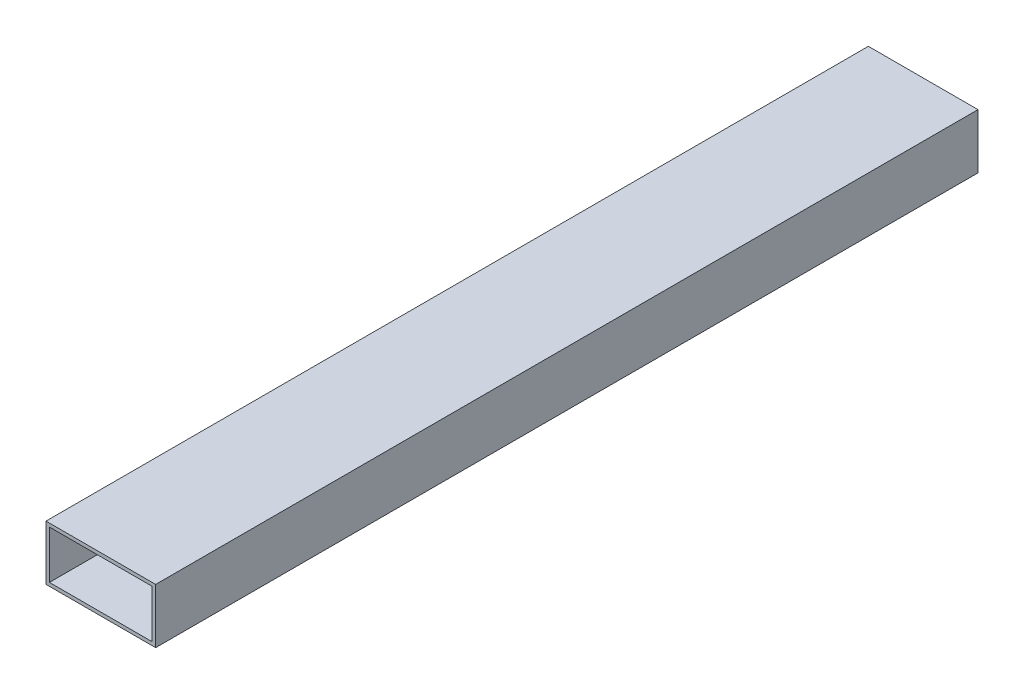
from build123d import *

# Parameters (mm, degrees)
SKETCH1_W           = 50.8
SKETCH1_H           = 25.4
SKETCH1_W_2         = 47.625
SKETCH1_H_2         = 22.225
BOSS_EXTRUDE1_DEPTH = 381


with BuildPart() as part:
    # Sketch1 → Boss-Extrude1 (new body)
    with BuildSketch(Plane.XY):
        Rectangle(SKETCH1_W, SKETCH1_H)
        Rectangle(SKETCH1_W_2, SKETCH1_H_2, mode=Mode.SUBTRACT)
    extrude(amount=BOSS_EXTRUDE1_DEPTH)


solid = part.part
